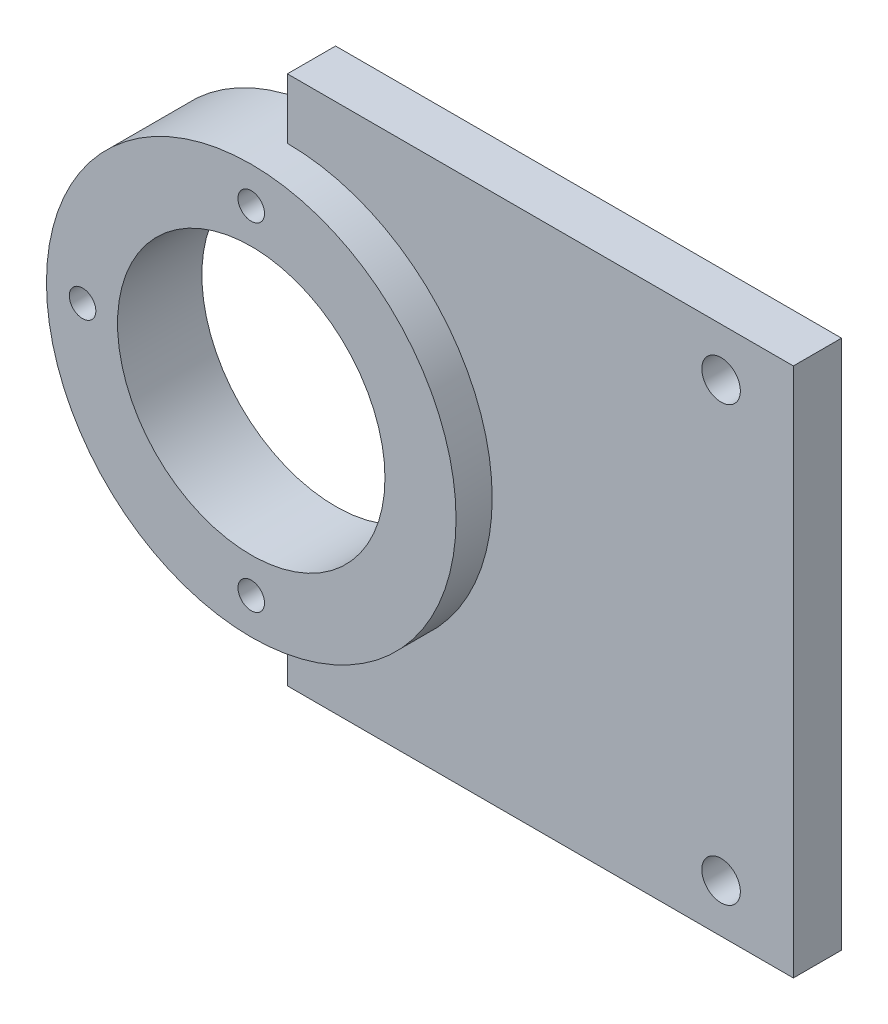
from build123d import *

# Parameters (mm, degrees)
BEARING_HOUSING_PROFILE_R          = 17
BEARING_HOUSING_PROFILE_R_2        = 11.1
BEARING_HOUSING_DEPTH              = 7
MOUNTING_WEB_PROFILE_W             = 42
MOUNTING_WEB_PROFILE_H             = 44
MOUNTING_WEB_DEPTH                 = 4
BEARING_SEAT_START                 = -50
BEARING_SEAT_PROFILE_R             = 11.1
BEARING_SEAT_DEPTH                 = 98.927027865
STANDOFF_FASTENERS_START           = -50
STANDOFF_FASTENERS_PROFILE_R       = 1.6
STANDOFF_FASTENERS_DEPTH           = 98.927027865
BEARING_KEEPER_FASTENERS_START     = -50
BEARING_KEEPER_FASTENERS_PROFILE_R = 1.1
BEARING_KEEPER_FASTENERS_DEPTH     = 98.927027865


with BuildPart() as part:
    # Bearing_housing_profile → Bearing_housing (new body)
    with BuildSketch(Plane.XY):
        Circle(BEARING_HOUSING_PROFILE_R)
        Circle(BEARING_HOUSING_PROFILE_R_2, mode=Mode.SUBTRACT)
    extrude(amount=BEARING_HOUSING_DEPTH)

    # Mounting_web_profile → Mounting_web (add)
    with BuildSketch(Plane.XY):
        with Locations((21, 0)):
            Rectangle(MOUNTING_WEB_PROFILE_W, MOUNTING_WEB_PROFILE_H)
    extrude(amount=MOUNTING_WEB_DEPTH)

    # Bearing_seat_profile → Bearing_seat (cut, through all)
    with BuildSketch(Plane.XY.offset(BEARING_SEAT_START)):
        Circle(BEARING_SEAT_PROFILE_R)
    extrude(amount=BEARING_SEAT_DEPTH, mode=Mode.SUBTRACT)

    # Standoff_fasteners_profile → Standoff_fasteners (cut, through all)
    with BuildSketch(Plane.XY.offset(STANDOFF_FASTENERS_START)):
        with Locations(Location((36, -18, 0), (0, 0, 180))):
            Circle(STANDOFF_FASTENERS_PROFILE_R)
        with Locations(Location((36, 18, 0), (0, 0, 180))):
            Circle(STANDOFF_FASTENERS_PROFILE_R)
    extrude(amount=STANDOFF_FASTENERS_DEPTH, mode=Mode.SUBTRACT)

    # Bearing_keeper_fasteners_profile → Bearing_keeper_fasteners (cut, through all)
    with BuildSketch(Plane.XY.offset(BEARING_KEEPER_FASTENERS_START)):
        with Locations(Location((-14, 0, 0), (0, 0, 180))):
            Circle(BEARING_KEEPER_FASTENERS_PROFILE_R)
        with Locations(Location((0, -14, 0), (0, 0, 180))):
            Circle(BEARING_KEEPER_FASTENERS_PROFILE_R)
        with Locations(Location((0, 14, 0), (0, 0, 180))):
            Circle(BEARING_KEEPER_FASTENERS_PROFILE_R)
    extrude(amount=BEARING_KEEPER_FASTENERS_DEPTH, mode=Mode.SUBTRACT)


solid = part.part
